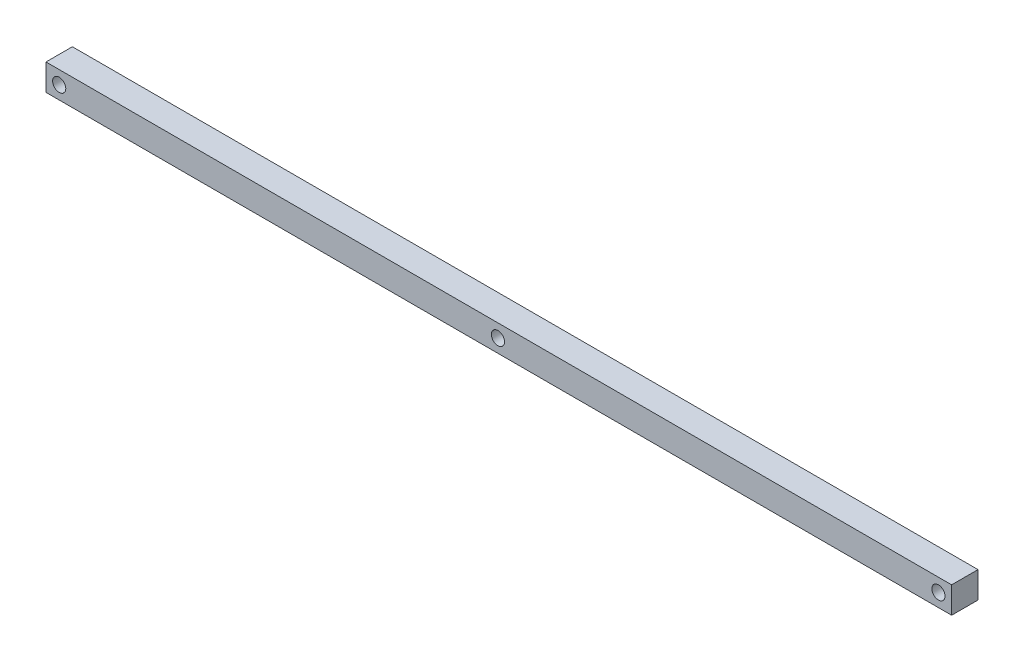
from build123d import *

# Parameters (mm, degrees)
SKETCH1_W           = 1030
SKETCH1_H           = 30
SKETCH1_R           = 7.5
BOSS_EXTRUDE1_DEPTH = 15


with BuildPart() as part:
    # Sketch1 → Boss-Extrude1 (new, symmetric)
    with BuildSketch(Plane.XY):
        Rectangle(SKETCH1_W, SKETCH1_H)
        with Locations((-500, 0)):
            Circle(SKETCH1_R, mode=Mode.SUBTRACT)
        with Locations((500, 0)):
            Circle(SKETCH1_R, mode=Mode.SUBTRACT)
        with Locations((-1, 0)):
            Circle(SKETCH1_R, mode=Mode.SUBTRACT)
    extrude(amount=BOSS_EXTRUDE1_DEPTH, both=True)


solid = part.part
